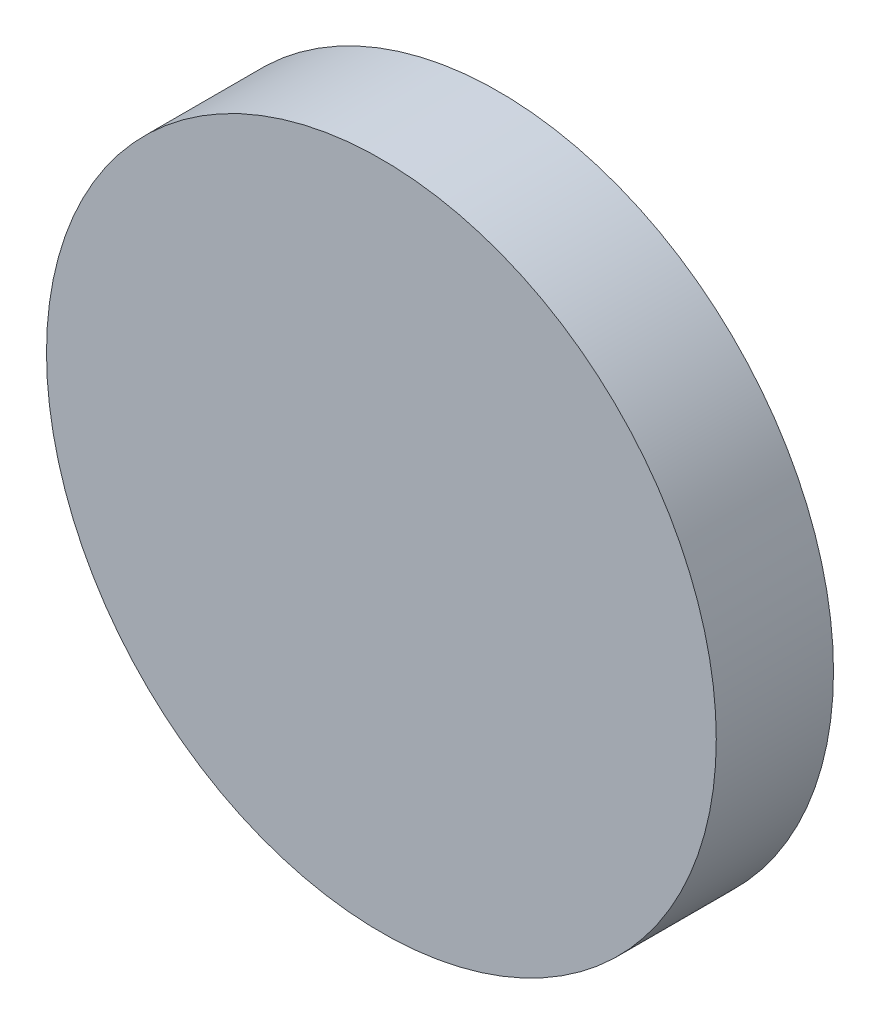
from build123d import *

# Parameters (mm, degrees)
SKETCH1_R           = 20
BOSS_EXTRUDE1_DEPTH = 7


with BuildPart() as part:
    # Sketch1 → Boss-Extrude1 (new body)
    with BuildSketch(Plane.XY):
        Circle(SKETCH1_R)
    extrude(amount=BOSS_EXTRUDE1_DEPTH)


solid = part.part
